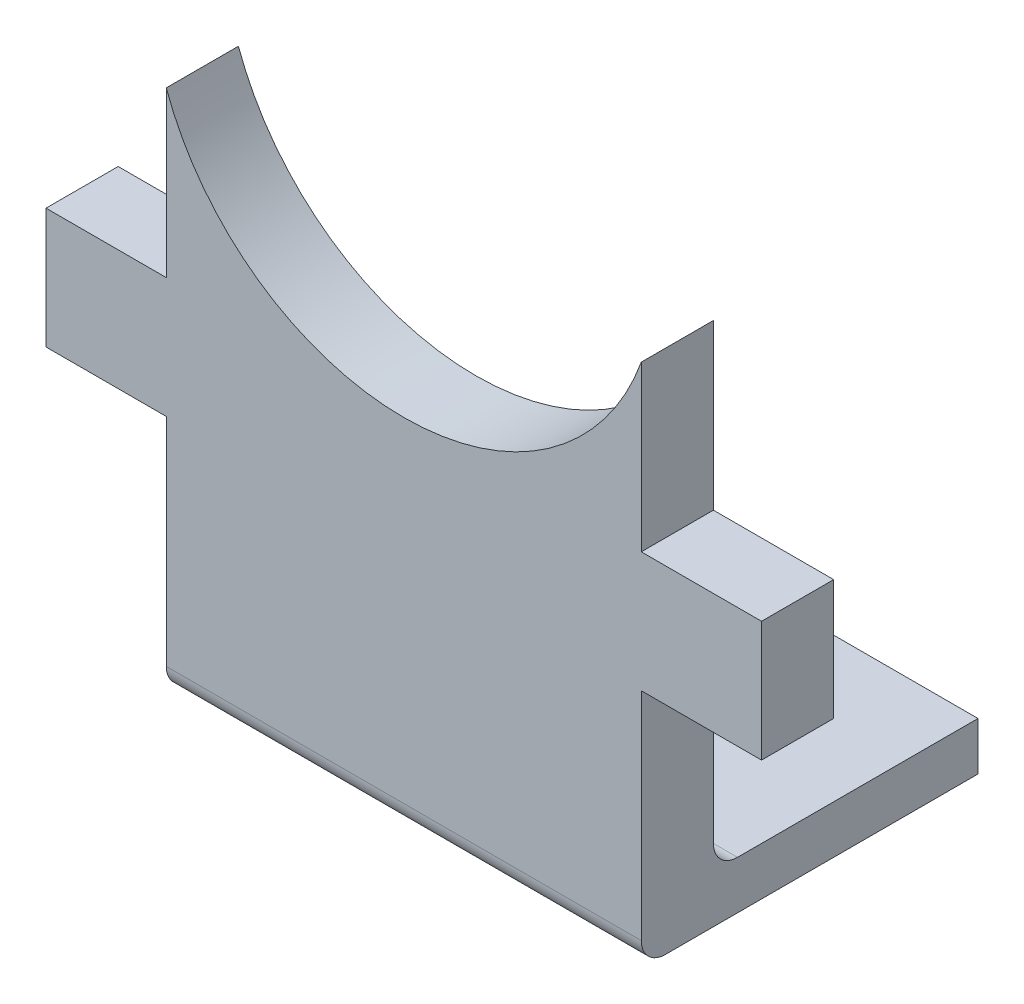
from build123d import *

# Parameters (mm, degrees)
CROQUIS1_R              = 9.875
CROQUIS1_W              = 5
CROQUIS1_H              = 5
SALIENTE_EXTRUIR1_DEPTH = 3
REDONDEO1_R             = 1
CROQUIS2_R              = 10.5
CORTAR_EXTRUIR1_DEPTH   = 10
CROQUIS3_W              = 19.75
CROQUIS3_H              = 2
SALIENTE_EXTRUIR2_DEPTH = 11
REDONDEO2_R             = 1


with BuildPart() as part:
    # Croquis1 → Saliente-Extruir1 (new body)
    with BuildSketch(Plane.XY):
        Circle(CROQUIS1_R)
        with BuildLine():
            ThreePointArc((9.875, 0), (0, -9.875), (-9.875, 0))
            Line((-9.875, 0), (-9.875, -10.4))
            Line((-9.875, -10.4), (-9.875, -15.4))
            Line((-9.875, -15.4), (-9.875, -25.4))
            Line((-9.875, -25.4), (9.875, -25.4))
            Line((9.875, -25.4), (9.875, -15.4))
            Line((9.875, -15.4), (9.875, -10.4))
            Line((9.875, -10.4), (9.875, 0))
        make_face()
        with Locations((12.375, -12.9)):
            Rectangle(CROQUIS1_W, CROQUIS1_H)
        with Locations((-12.375, -12.9)):
            Rectangle(CROQUIS1_W, CROQUIS1_H)
    extrude(amount=SALIENTE_EXTRUIR1_DEPTH)

    # Redondeo1
    redondeo1_edges = [part.edges().sort_by_distance(p)[0] for p in [
        (0, -25.4, 3),
    ]]
    fillet(redondeo1_edges, radius=REDONDEO1_R)

    # Croquis2 → Cortar-Extruir1 (cut)
    with BuildSketch(Plane.XY.offset(3)):
        Circle(CROQUIS2_R)
    extrude(amount=-CORTAR_EXTRUIR1_DEPTH, mode=Mode.SUBTRACT)

    # Croquis3 → Saliente-Extruir2 (add)
    with BuildSketch(Plane(origin=(0, 0, 0), x_dir=(-1, 0, 0), z_dir=(0, 0, -1))):
        with Locations((0, -24.4)):
            Rectangle(CROQUIS3_W, CROQUIS3_H)
    extrude(amount=SALIENTE_EXTRUIR2_DEPTH)

    # Redondeo2
    redondeo2_edges = [part.edges().sort_by_distance(p)[0] for p in [
        (0, -23.4, 0),
    ]]
    fillet(redondeo2_edges, radius=REDONDEO2_R)


solid = part.part
